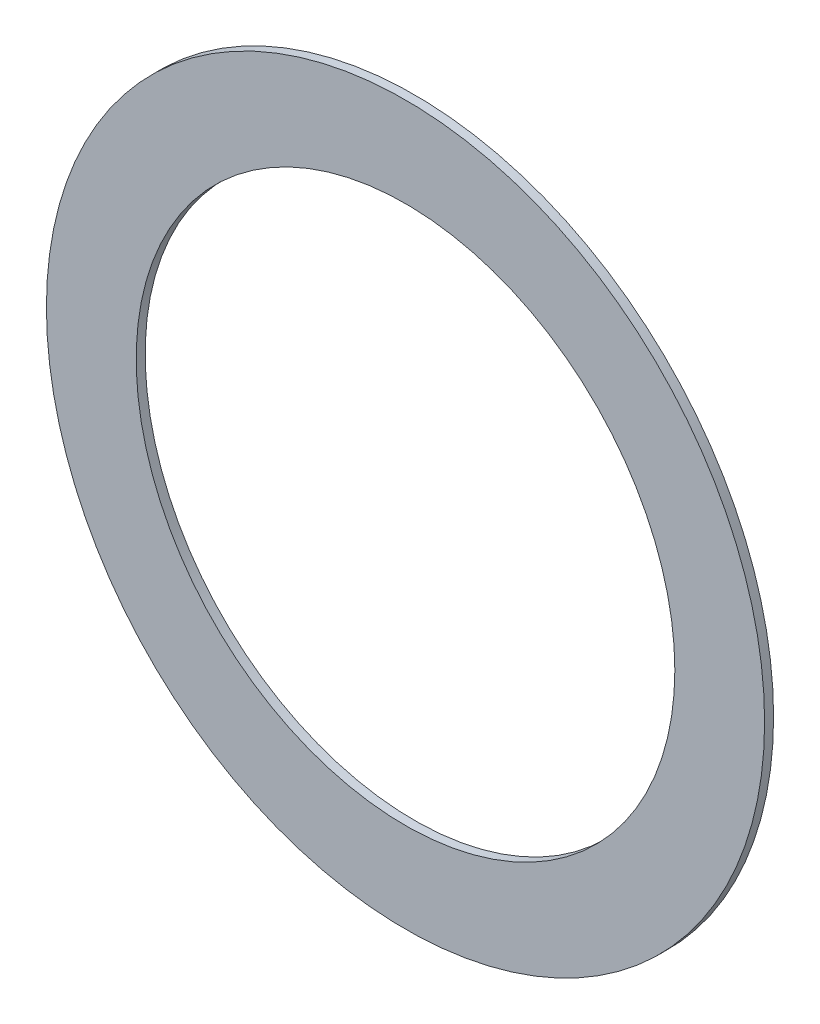
from build123d import *

# Parameters (mm, degrees)
SKETCH_1_R      = 8
SKETCH_1_R_2    = 6
EXTRUDE_1_DEPTH = 0.1


with BuildPart() as part:
    # 草图1 → 凸台-拉伸1 (new, symmetric)
    with BuildSketch(Plane.XY):
        Circle(SKETCH_1_R)
        Circle(SKETCH_1_R_2, mode=Mode.SUBTRACT)
    extrude(amount=EXTRUDE_1_DEPTH, both=True)


solid = part.part
